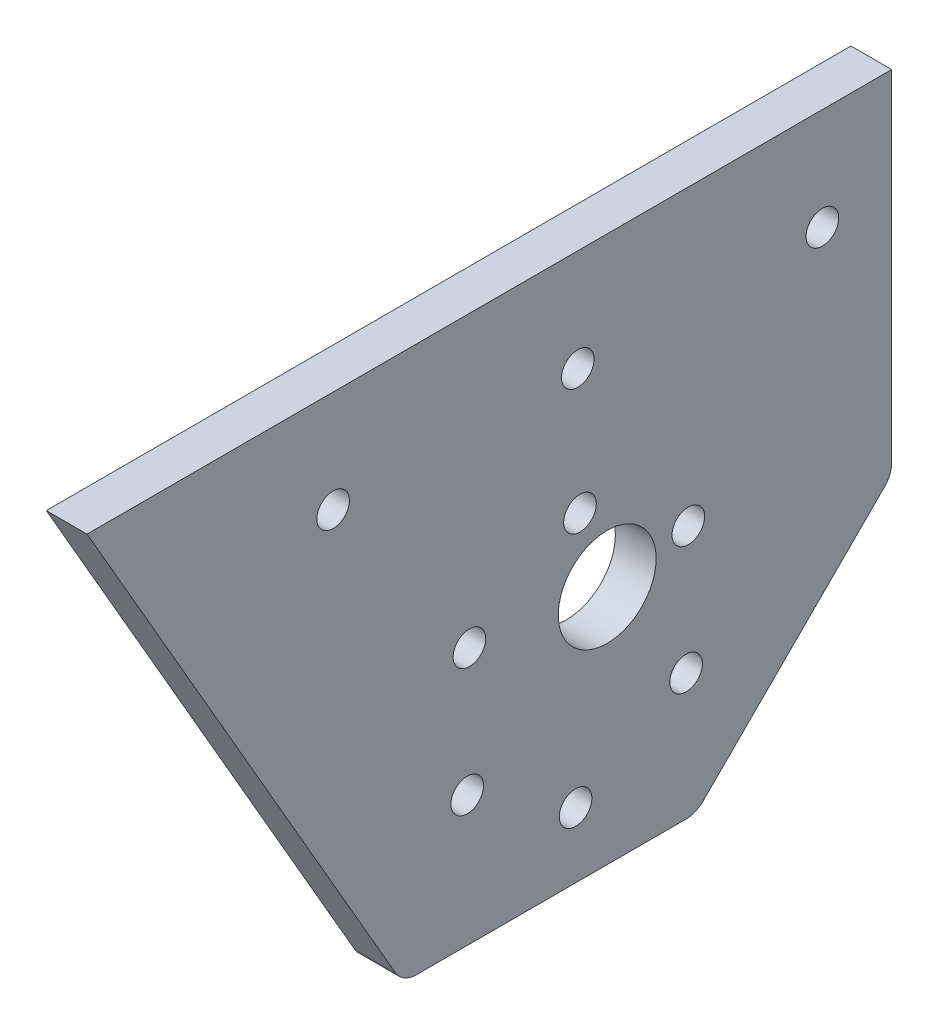
from build123d import *

# Parameters (mm, degrees)
SKETCH1_R           = 6
SKETCH1_R_2         = 2
BOSS_EXTRUDE1_DEPTH = 5


with BuildPart() as part:
    # Sketch1 → Boss-Extrude1 (new body)
    with BuildSketch(Plane(origin=(0, 0, 0), x_dir=(0, 0, -1), z_dir=(1, 0, 0))):
        with BuildLine():
            Line((34.894448725, 36.555579518), (34.894448725, -4.257359313))
            ThreePointArc((34.894448725, -4.257359313), (34.666087322, -5.40540961), (34.015769068, -6.378679656))
            Line((34.015769068, -6.378679656), (11.773128381, -28.621320344))
            ThreePointArc((11.773128381, -28.621320344), (10.799858335, -29.271638598), (9.651808037, -29.5))
            Line((9.651808037, -29.5), (-23.373500468, -29.5))
            ThreePointArc((-23.373500468, -29.5), (-24.873500468, -29.098076211), (-25.971576679, -28))
            Line((-25.971576679, -28), (-63.788019311, 37.5))
            Line((-63.788019311, 37.5), (34.894448725, 37.5))
            Line((34.894448725, 37.5), (34.894448725, 36.555579518))
        make_face()
        Circle(SKETCH1_R, mode=Mode.SUBTRACT)
        with Locations((9.68016301, -13.983720681)):
            Circle(SKETCH1_R_2, mode=Mode.SUBTRACT)
        with Locations((-3.876799059, -21.49762642)):
            Circle(SKETCH1_R_2, mode=Mode.SUBTRACT)
        with Locations((-17.162513345, -13.513905738)):
            Circle(SKETCH1_R_2, mode=Mode.SUBTRACT)
        with Locations((-16.891265561, 1.983720681)):
            Circle(SKETCH1_R_2, mode=Mode.SUBTRACT)
        with Locations((-3.334303492, 9.49762642)):
            Circle(SKETCH1_R_2, mode=Mode.SUBTRACT)
        with Locations((9.951410794, 1.513905738)):
            Circle(SKETCH1_R_2, mode=Mode.SUBTRACT)
        with Locations((-3.605551275, 25)):
            Circle(SKETCH1_R_2, mode=Mode.SUBTRACT)
        with Locations((26.394448725, 25)):
            Circle(SKETCH1_R_2, mode=Mode.SUBTRACT)
        with Locations((-33.605551275, 25)):
            Circle(SKETCH1_R_2, mode=Mode.SUBTRACT)
    extrude(amount=BOSS_EXTRUDE1_DEPTH)


solid = part.part
